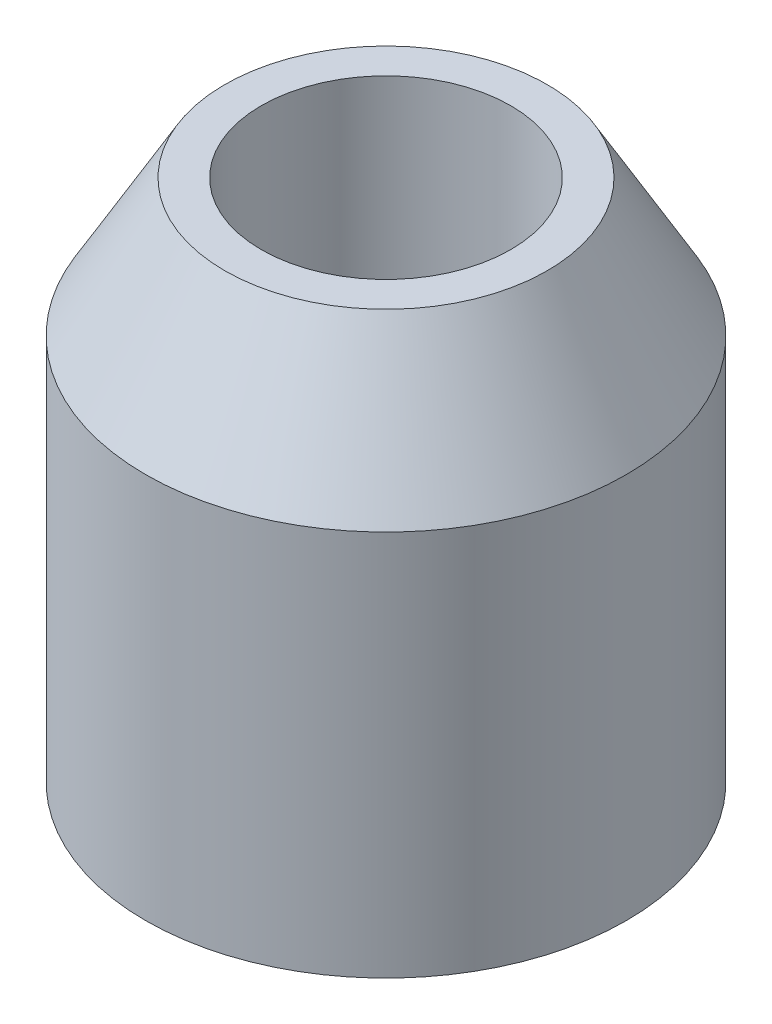
from build123d import *


with BuildPart() as part:
    # Sketch1 → Revolve1 (revolve)
    with BuildSketch(Plane.XY, mode=Mode.PRIVATE) as revolve1_sk:
        Polygon((19.75, 31.741669751), (19.75, 0), (16.75, 0), (16.75, 28), (10.25, 28), (10.25, 43), (13.25, 43), align=None)
    revolve(revolve1_sk.sketch.rotate(Axis((0, 63.070411612, 0), (0, -1, 0)), 90), axis=Axis((0, 63.070411612, 0), (0, -1, 0)))


solid = part.part
